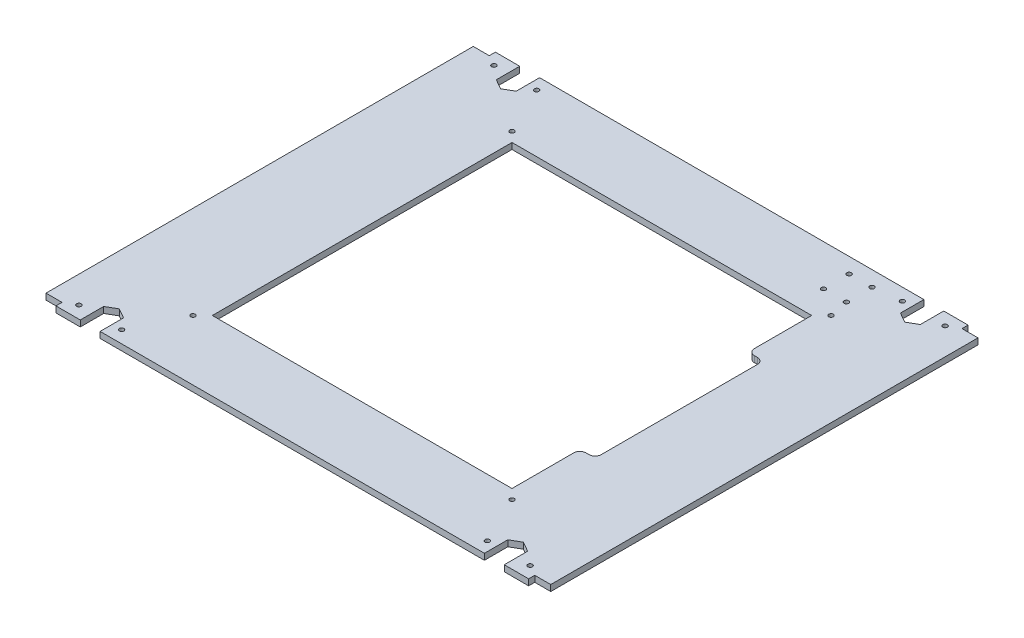
from build123d import *

# Parameters (mm, degrees)
SKETCH1_R           = 1.5
SKETCH1_W           = 196.314766664
SKETCH1_H           = 196.314766664
BOSS_EXTRUDE1_DEPTH = 4
SKETCH7_W           = 110.317049386
SKETCH7_H           = 4
CUT_EXTRUDE1_DEPTH  = 10
FILLET1_R           = 4


with BuildPart() as part:
    # Sketch1 → Boss-Extrude1 (new body)
    with BuildSketch(Plane(origin=(0, 0, 0), x_dir=(1, 0, 0), z_dir=(0, 1, 0))):
        Polygon((154.855, -139.95), (165.325, -139.95), (165.325, 139.95), (154.855, 139.95), (154.855, 143.95), (138.875, 143.95), (138.875, 128.61722325), (132.375, 124.864446501), (125.875, 128.61722325), (125.875, 143.95), (-125.875, 143.95), (-125.875, 128.61722325), (-132.375, 124.864446501), (-138.875, 128.61722325), (-138.875, 143.95), (-154.855, 143.95), (-154.855, 139.95), (-165.325, 139.95), (-165.325, -139.95), (-154.855, -139.95), (-154.855, -143.95), (-138.875, -143.95), (-138.875, -128.61722325), (-132.375, -124.864446501), (-125.875, -128.61722325), (-125.875, -143.95), (125.875, -143.95), (125.875, -128.61722325), (132.375, -124.864446501), (138.875, -128.61722325), (138.875, -143.95), (154.855, -143.95), align=None)
        with Locations((-147.795, -135.95)):
            Circle(SKETCH1_R, mode=Mode.SUBTRACT)
        with Locations((-119.795, -135.95)):
            Circle(SKETCH1_R, mode=Mode.SUBTRACT)
        with Locations((-104.5, -104.5)):
            Circle(SKETCH1_R, mode=Mode.SUBTRACT)
        with Locations((119.795, -135.95)):
            Circle(SKETCH1_R, mode=Mode.SUBTRACT)
        with Locations((147.795, -135.95)):
            Circle(SKETCH1_R, mode=Mode.SUBTRACT)
        with Locations((104.5, -104.5)):
            Circle(SKETCH1_R, mode=Mode.SUBTRACT)
        with Locations((-104.5, 104.5)):
            Circle(SKETCH1_R, mode=Mode.SUBTRACT)
        with Locations((-147.795, 135.95)):
            Circle(SKETCH1_R, mode=Mode.SUBTRACT)
        with Locations((-119.795, 135.95)):
            Circle(SKETCH1_R, mode=Mode.SUBTRACT)
        Rectangle(SKETCH1_W, SKETCH1_H, mode=Mode.SUBTRACT)
        with Locations((104.5, 104.5)):
            Circle(SKETCH1_R, mode=Mode.SUBTRACT)
        with Locations((86.915968312, 117.1513625)):
            Circle(SKETCH1_R, mode=Mode.SUBTRACT)
        with Locations((101.875, 117.1513625)):
            Circle(SKETCH1_R, mode=Mode.SUBTRACT)
        with Locations((86.915968312, 133.95)):
            Circle(SKETCH1_R, mode=Mode.SUBTRACT)
        with Locations((101.875, 133.95)):
            Circle(SKETCH1_R, mode=Mode.SUBTRACT)
        with Locations((119.795, 135.95)):
            Circle(SKETCH1_R, mode=Mode.SUBTRACT)
        with Locations((147.795, 135.95)):
            Circle(SKETCH1_R, mode=Mode.SUBTRACT)
    extrude(amount=BOSS_EXTRUDE1_DEPTH)

    # Sketch7 → Cut-Extrude1 (cut)
    with BuildSketch(Plane.ZY.offset(-98.157383332)):
        with Locations((-1.45907227, 2)):
            Rectangle(SKETCH7_W, SKETCH7_H)
    extrude(amount=-CUT_EXTRUDE1_DEPTH, mode=Mode.SUBTRACT)

    # Fillet1
    fillet1_edges = [part.edges().sort_by_distance(p)[0] for p in [
        (108.157383332, 2, -56.617596963),
        (98.157383332, 2, -56.617596963),
        (108.157383332, 2, 53.699452423),
        (98.157383332, 2, 53.699452423),
    ]]
    fillet(fillet1_edges, radius=FILLET1_R)


solid = part.part
